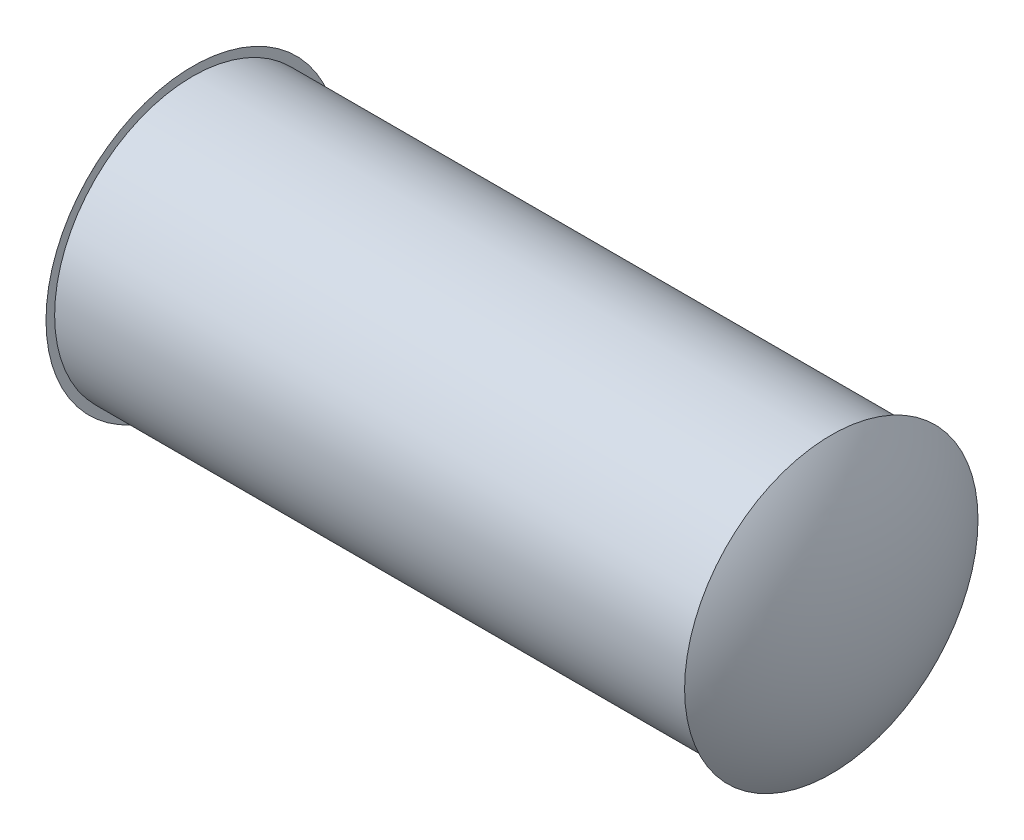
from build123d import *

# Parameters (mm, degrees)
BOSS_EXTRUDE1_DEPTH      = 9.398
BOSS_EXTRUDE1_DEPTH_BACK = 9.398
SKETCH1_R                = 4.064


with BuildPart() as part:
    # Sketch1 → Boss-Extrude1 (new, two sides: drawn at the far end of the back side and taken through both)
    with BuildSketch(Plane(origin=(0, 0, 0), x_dir=(0, 0, -1), z_dir=(1, 0, 0)).offset(-BOSS_EXTRUDE1_DEPTH_BACK)):
        Circle(SKETCH1_R)
    extrude(amount=BOSS_EXTRUDE1_DEPTH + BOSS_EXTRUDE1_DEPTH_BACK)

    # Sketch5 → Revolve1 (revolve)
    with BuildSketch(Plane(origin=(0, 0, 0), x_dir=(1, 0, 0), z_dir=(0, 1, 0))):
        with BuildLine():
            Line((9.398, 0), (9.398, 4.318))
            add(Edge.make_bspline(
                [(9.398, 4.318), (10.668, 2.595439575), (10.668, 0)],
                knots=[0, 0, 0, 1, 1, 1], degree=2))
            Line((10.668, 0), (9.398, 0))
        make_face()
    revolve1 = revolve(axis=Axis((9.398, 0, 0), (1, 0, 0)))

    # Mirror1: Revolve1 across plane
    add(revolve1.mirror(Plane(origin=(0, 0, 0), x_dir=(0, 0, 1), z_dir=(1, 0, 0))))


solid = part.part
